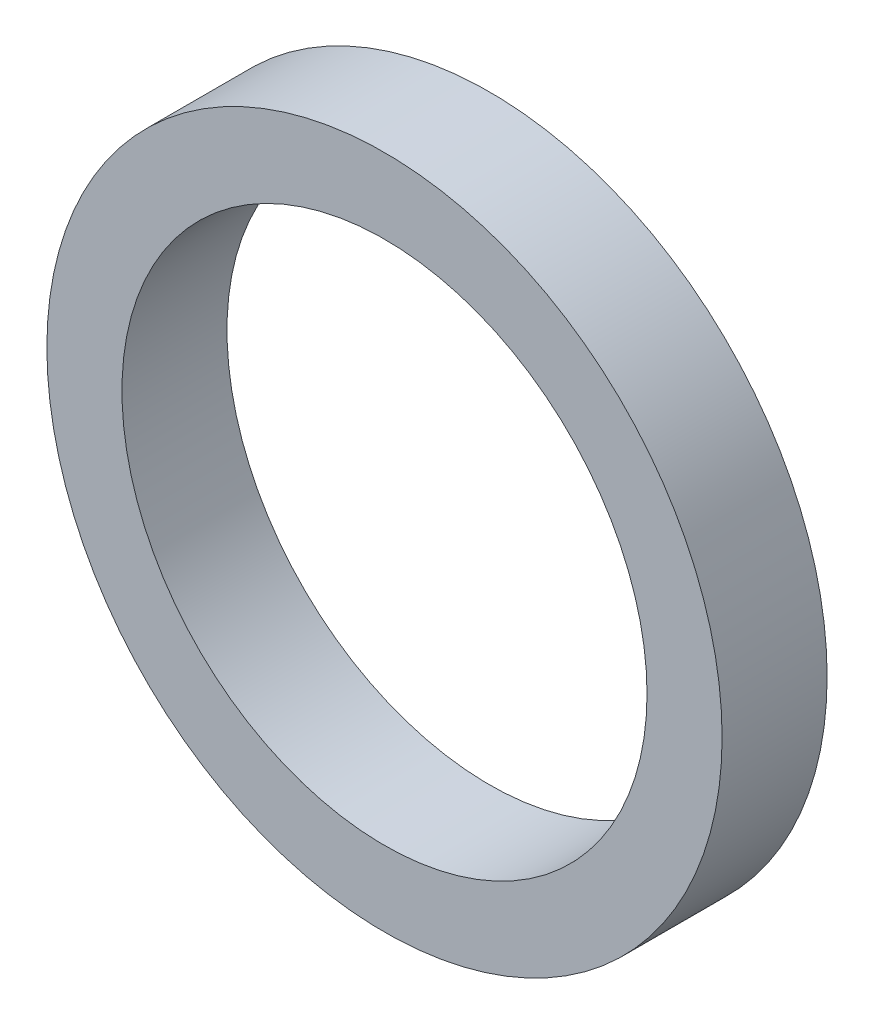
from build123d import *

# Parameters (mm, degrees)
SCHIZZO1_R                   = 3.215
SCHIZZO1_R_2                 = 2.5
ESTRUSIONE_ESTRUSIONE1_DEPTH = 1


with BuildPart() as part:
    # Schizzo1 → Estrusione-Estrusione1 (new body)
    with BuildSketch(Plane.XY):
        Circle(SCHIZZO1_R)
        Circle(SCHIZZO1_R_2, mode=Mode.SUBTRACT)
    extrude(amount=ESTRUSIONE_ESTRUSIONE1_DEPTH)


solid = part.part
